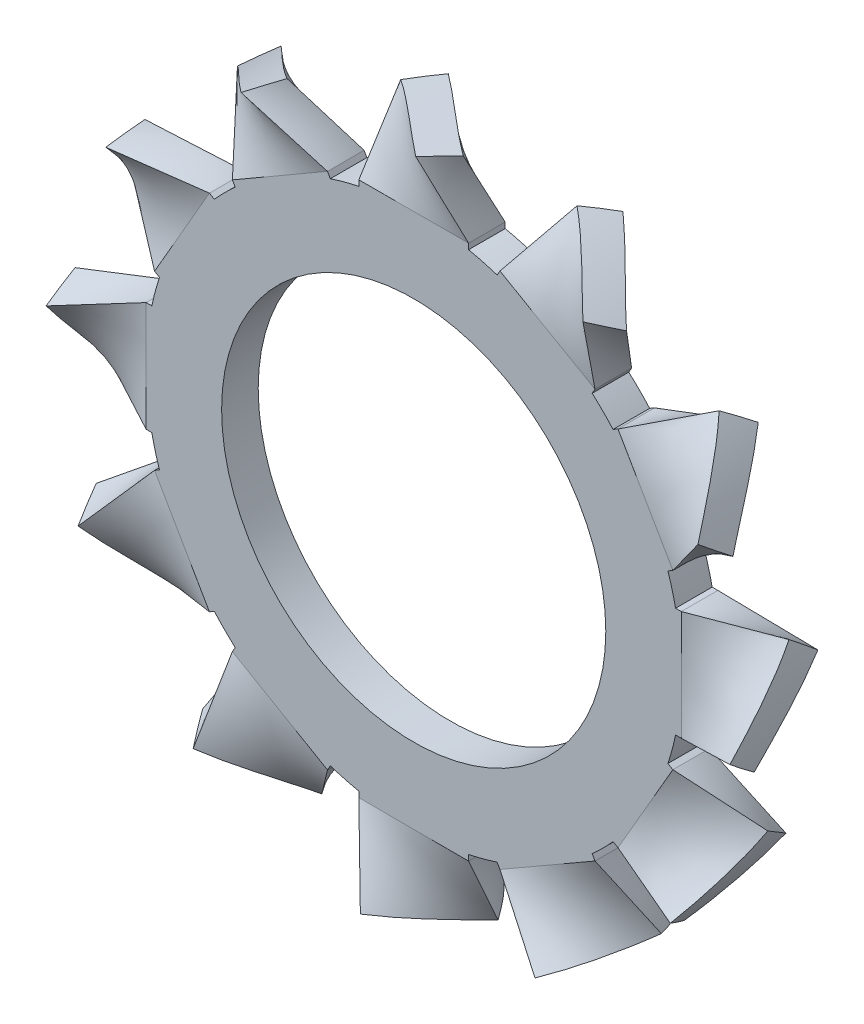
from build123d import *

# Parameters (mm, degrees)
SKETCH4_W               = 2.4
SKETCH4_H               = 0.8
EXTRUDE1_DEPTH          = 1.65
CIRPATTERN1_COUNT       = 12
EXTRUDE2_DEPTH          = 0.4
EXTRUDE2_DEPTH_BACK     = 0.4
SKETCH5_R               = 5.85
SKETCH5_R_2             = 4.2
CUT_EXTRUDE1_DEPTH      = 11.650862746
CUT_EXTRUDE1_DEPTH_BACK = 11.650862746
SKETCH6_OUTSIDE_W       = 21.26
SKETCH6_OUTSIDE_H       = 21.26
SKETCH6_OUTSIDE_R       = 7.5


with BuildPart() as part:
    # Sketch3 → Loft1 section 0
    with BuildSketch(Plane(origin=(0, 7.5, 0), x_dir=(-1, 0, 0), z_dir=(0, 1, 0))):
        with BuildLine():
            Line((1.058731538, -0.418434619), (0.595924459, -0.969986618))
            Line((0.595924459, -0.969986618), (-1.058731538, 0.418434619))
            Line((-1.058731538, 0.418434619), (-0.595924459, 0.969986618))
            Line((-0.595924459, 0.969986618), (1.058731538, -0.418434619))
        make_face()
    # Sketch2 → Loft1 section 1
    with BuildSketch(Plane(origin=(0, 5.85, 0), x_dir=(-1, 0, 0), z_dir=(0, 1, 0))):
        with BuildLine():
            Line((-1.2, 0.4), (1.2, 0.4))
            Line((1.2, 0.4), (1.2, -0.4))
            Line((1.2, -0.4), (-1.2, -0.4))
            Line((-1.2, -0.4), (-1.2, 0.4))
        make_face()
    loft()

    # Sketch4 → Extrude1 (add)
    with BuildSketch(Plane.XZ.offset(-5.85)):
        Rectangle(SKETCH4_W, SKETCH4_H)
    extrude(amount=EXTRUDE1_DEPTH)


with BuildPart() as cirpattern1_1:
    # CirPattern1: pattern copy
    add(part.part.rotate(Axis((0, 0, -0.606571826), (0, 0, 1)), 1 * 360 / CIRPATTERN1_COUNT))


with BuildPart() as cirpattern1_2:
    # CirPattern1: pattern copy
    add(part.part.rotate(Axis((0, 0, -0.606571826), (0, 0, 1)), 2 * 360 / CIRPATTERN1_COUNT))


with BuildPart() as cirpattern1_3:
    # CirPattern1: pattern copy
    add(part.part.rotate(Axis((0, 0, -0.606571826), (0, 0, 1)), 3 * 360 / CIRPATTERN1_COUNT))


with BuildPart() as cirpattern1_4:
    # CirPattern1: pattern copy
    add(part.part.rotate(Axis((0, 0, -0.606571826), (0, 0, 1)), 4 * 360 / CIRPATTERN1_COUNT))


with BuildPart() as cirpattern1_5:
    # CirPattern1: pattern copy
    add(part.part.rotate(Axis((0, 0, -0.606571826), (0, 0, 1)), 5 * 360 / CIRPATTERN1_COUNT))


with BuildPart() as cirpattern1_6:
    # CirPattern1: pattern copy
    add(part.part.rotate(Axis((0, 0, -0.606571826), (0, 0, 1)), 6 * 360 / CIRPATTERN1_COUNT))


with BuildPart() as cirpattern1_7:
    # CirPattern1: pattern copy
    add(part.part.rotate(Axis((0, 0, -0.606571826), (0, 0, 1)), 7 * 360 / CIRPATTERN1_COUNT))


with BuildPart() as cirpattern1_8:
    # CirPattern1: pattern copy
    add(part.part.rotate(Axis((0, 0, -0.606571826), (0, 0, 1)), 8 * 360 / CIRPATTERN1_COUNT))


with BuildPart() as cirpattern1_9:
    # CirPattern1: pattern copy
    add(part.part.rotate(Axis((0, 0, -0.606571826), (0, 0, 1)), 9 * 360 / CIRPATTERN1_COUNT))


with BuildPart() as cirpattern1_10:
    # CirPattern1: pattern copy
    add(part.part.rotate(Axis((0, 0, -0.606571826), (0, 0, 1)), 10 * 360 / CIRPATTERN1_COUNT))


with BuildPart() as cirpattern1_11:
    # CirPattern1: pattern copy
    add(part.part.rotate(Axis((0, 0, -0.606571826), (0, 0, 1)), 11 * 360 / CIRPATTERN1_COUNT))


with BuildPart() as part_1:
    add(part.part)

    add(cirpattern1_1.part)  # Extrude2 merges CirPattern1_1

    add(cirpattern1_2.part)  # Extrude2 merges CirPattern1_2

    add(cirpattern1_3.part)  # Extrude2 merges CirPattern1_3

    add(cirpattern1_4.part)  # Extrude2 merges CirPattern1_4

    add(cirpattern1_5.part)  # Extrude2 merges CirPattern1_5

    add(cirpattern1_6.part)  # Extrude2 merges CirPattern1_6

    add(cirpattern1_7.part)  # Extrude2 merges CirPattern1_7

    add(cirpattern1_8.part)  # Extrude2 merges CirPattern1_8

    add(cirpattern1_9.part)  # Extrude2 merges CirPattern1_9

    add(cirpattern1_10.part)  # Extrude2 merges CirPattern1_10

    add(cirpattern1_11.part)  # Extrude2 merges CirPattern1_11
    # Sketch5 → Extrude2 (add, two sides: drawn at the far end of the back side and taken through both)
    with BuildSketch(Plane.XY.offset(-EXTRUDE2_DEPTH_BACK)):
        Circle(SKETCH5_R)
        with Locations(Location((0, 0, 0), (0, 0, 180))):
            Circle(SKETCH5_R_2, mode=Mode.SUBTRACT)
    extrude(amount=EXTRUDE2_DEPTH + EXTRUDE2_DEPTH_BACK)

    # Sketch6 outside → Cut-Extrude1 (cut, two sides: drawn at the far end of the back side and taken through both)
    with BuildSketch(Plane.XY.offset(-CUT_EXTRUDE1_DEPTH_BACK)):
        Rectangle(SKETCH6_OUTSIDE_W, SKETCH6_OUTSIDE_H)
        Circle(SKETCH6_OUTSIDE_R, mode=Mode.SUBTRACT)
    extrude(amount=CUT_EXTRUDE1_DEPTH + CUT_EXTRUDE1_DEPTH_BACK, mode=Mode.SUBTRACT)


solid = part_1.part
